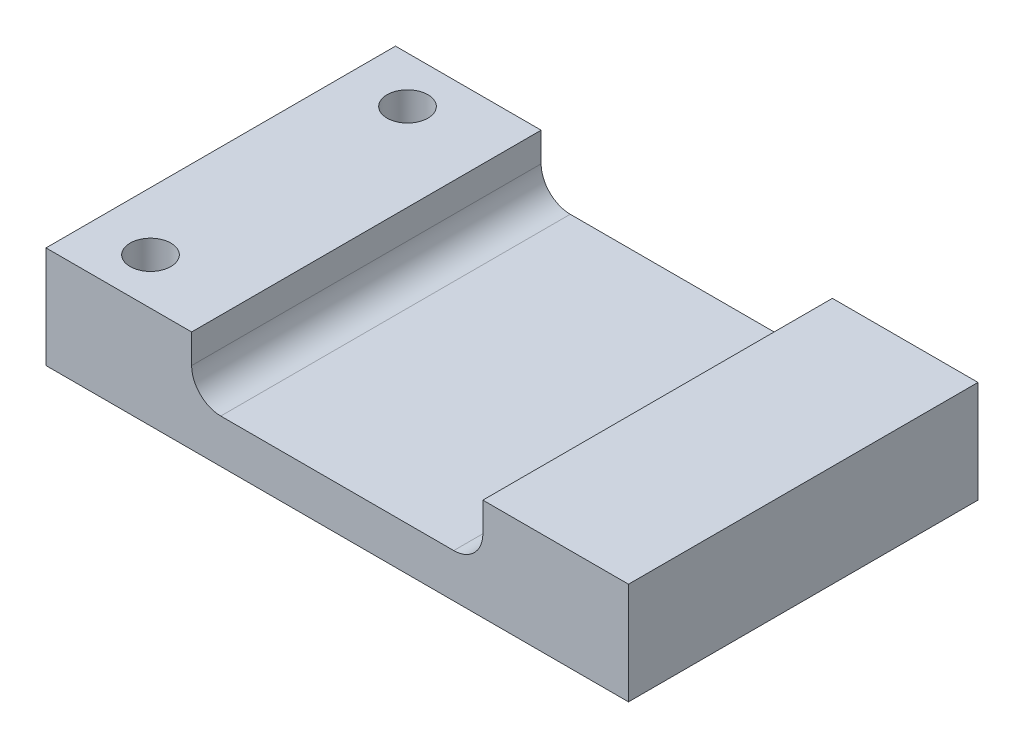
from build123d import *

# Parameters (mm, degrees)
SKETCH1_W           = 40
SKETCH1_H           = 24
SKETCH1_R           = 1.4
BOSS_EXTRUDE1_DEPTH = 7
SKETCH2_W           = 20
SKETCH2_H           = 24
CUT_EXTRUDE1_DEPTH  = 4
FILLET1_R           = 2
CUT_EXTRUDE2_DEPTH  = 2.5


with BuildPart() as part:
    # Sketch1 → Boss-Extrude1 (new body)
    with BuildSketch(Plane(origin=(0, 0, 0), x_dir=(1, 0, 0), z_dir=(0, 1, 0))):
        Rectangle(SKETCH1_W, SKETCH1_H)
        with Locations(Location((-16, 8.825, 0), (0, 0, 270))):
            Circle(SKETCH1_R, mode=Mode.SUBTRACT)
        with Locations(Location((-16, -8.825, 0), (0, 0, 270))):
            Circle(SKETCH1_R, mode=Mode.SUBTRACT)
    extrude(amount=BOSS_EXTRUDE1_DEPTH)

    # Sketch2 → Cut-Extrude1 (cut)
    with BuildSketch(Plane(origin=(0, 7, 0), x_dir=(1, 0, 0), z_dir=(0, 1, 0))):
        Rectangle(SKETCH2_W, SKETCH2_H)
    extrude(amount=-CUT_EXTRUDE1_DEPTH, mode=Mode.SUBTRACT)

    # Fillet1
    fillet1_edges = [part.edges().sort_by_distance(p)[0] for p in [
        (-10, 3, 0),
        (10, 3, 0),
    ]]
    fillet(fillet1_edges, radius=FILLET1_R)

    # Sketch3 → Cut-Extrude2 (cut)
    with BuildSketch(Plane.XZ):
        Polygon((-14.4988893, 6.225), (-12.9977786, 8.825), (-14.4988893, 11.425), (-17.5011107, 11.425), (-19.0022214, 8.825), (-17.5011107, 6.225), align=None)
        Polygon((-14.4988893, -11.425), (-12.9977786, -8.825), (-14.4988893, -6.225), (-17.5011107, -6.225), (-19.0022214, -8.825), (-17.5011107, -11.425), align=None)
    extrude(amount=-CUT_EXTRUDE2_DEPTH, mode=Mode.SUBTRACT)


solid = part.part
